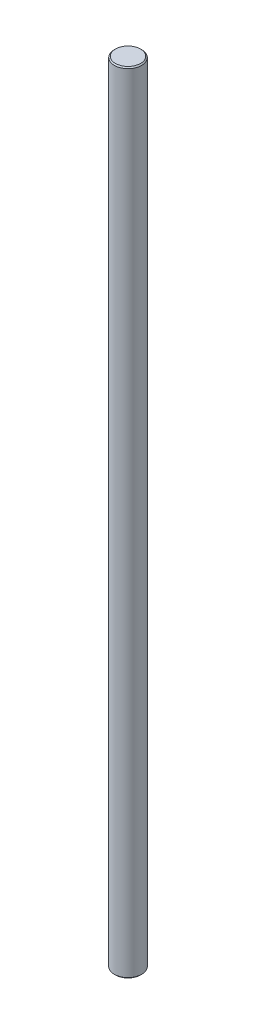
from build123d import *

# Parameters (mm, degrees)
CROQUIS1_R              = 6
SALIENTE_EXTRUIR1_DEPTH = 346.5
CHAFL_N1_SIZE           = 0.5


with BuildPart() as part:
    # Croquis1 → Saliente-Extruir1 (new body)
    with BuildSketch(Plane(origin=(0, -32.911818289, 0), x_dir=(1, 0, 0), z_dir=(0, 1, 0))):
        with Locations(Location((-109.028784153, -1.274422835, 0), (0, 0, 90))):
            Circle(CROQUIS1_R)
    extrude(amount=SALIENTE_EXTRUIR1_DEPTH)

    # Chaflán1
    chafl_n1_edges = [part.edges().sort_by_distance(p)[0] for p in [
        (-109.028784153, -32.911818289, 7.274422835),
        (-109.028784153, 313.588181711, 7.274422835),
    ]]
    chamfer(chafl_n1_edges, length=CHAFL_N1_SIZE)


solid = part.part
